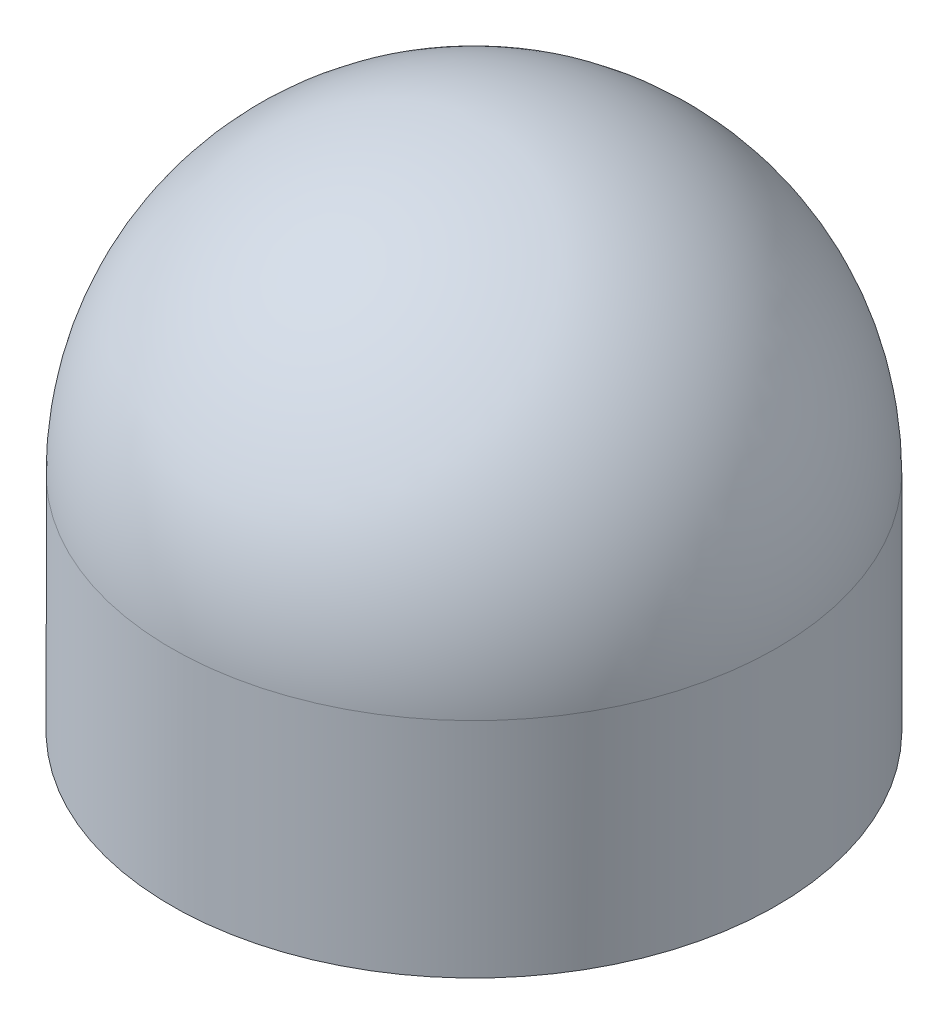
from build123d import *


with BuildPart() as part:
    # Sketch2 → Revolve1 (revolve)
    with BuildSketch(Plane.XY, mode=Mode.PRIVATE) as revolve1_sk:
        with BuildLine():
            Line((0, 0), (4.75, 0))
            Line((4.75, 0), (4.75, 3.5))
            ThreePointArc((4.75, 3.5), (3.358757211, 6.858757211), (0, 8.25))
            Line((0, 8.25), (0, 0))
        make_face()
    revolve(revolve1_sk.sketch.rotate(Axis((0, 0, 0), (0, 1, 0)), 90), axis=Axis((0, 0, 0), (0, 1, 0)))


solid = part.part
